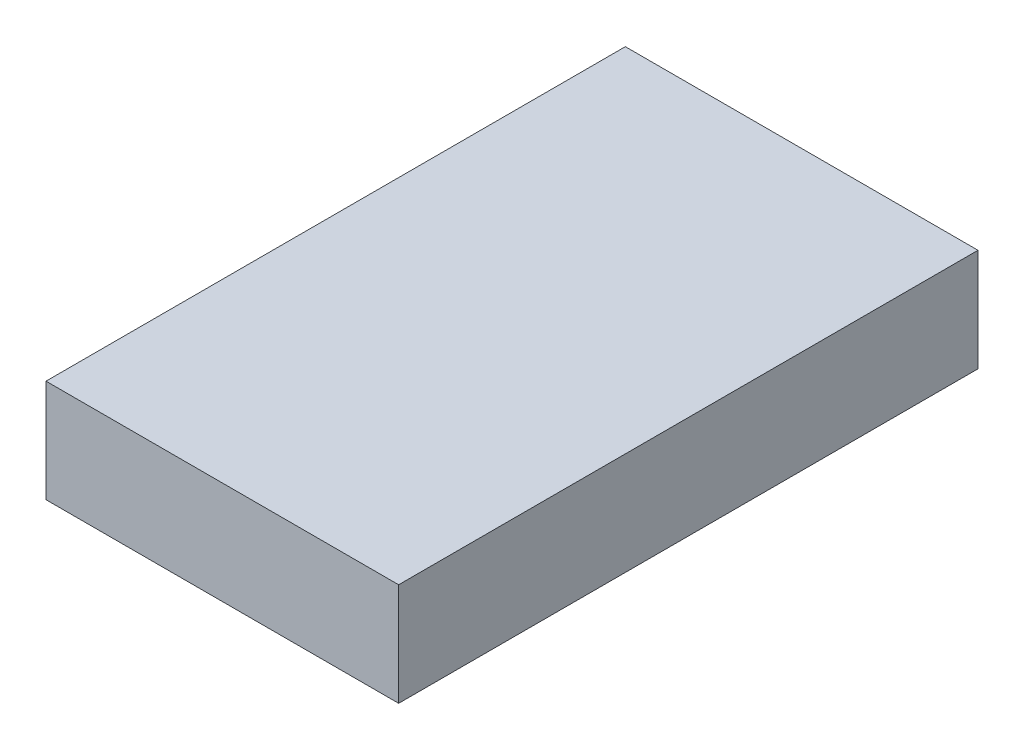
from build123d import *

# Parameters (mm, degrees)
SKETCH1_W           = 18.2
SKETCH1_H           = 29.9
BOSS_EXTRUDE1_DEPTH = 5.3


with BuildPart() as part:
    # Sketch1 → Boss-Extrude1 (new body)
    with BuildSketch(Plane(origin=(0, 0, 0), x_dir=(1, 0, 0), z_dir=(0, 1, 0))):
        Rectangle(SKETCH1_W, SKETCH1_H)
    extrude(amount=BOSS_EXTRUDE1_DEPTH)


solid = part.part
